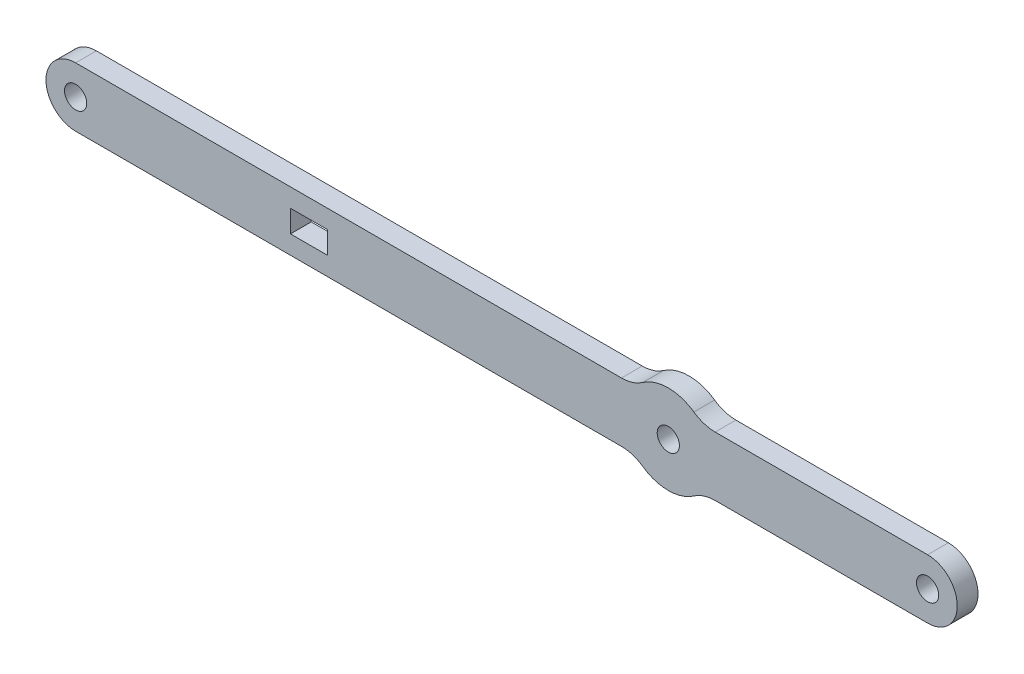
from build123d import *

# Parameters (mm, degrees)
SKETCH1_R           = 1.5
SKETCH1_W           = 5
SKETCH1_H           = 3
BOSS_EXTRUDE1_DEPTH = 2.8
FILLET1_R           = 5


with BuildPart() as part:
    # Sketch1 → Boss-Extrude1 (new body)
    with BuildSketch(Plane.XY):
        with BuildLine():
            Line((0.006174378, 4.000000753), (75.527864276, 4.000000258))
            ThreePointArc((75.527864276, 4.000000258), (80.000000039, 6), (84.472135776, 4.0000002))
            Line((84.472135776, 4.0000002), (115.000000079, 4))
            ThreePointArc((115.000000079, 4), (119, -5.2e-08), (114.999999974, -4))
            Line((114.999999974, -4), (84.472136134, -3.9999998))
            ThreePointArc((84.472136134, -3.9999998), (79.999999961, -6), (75.527863814, -3.999999742))
            Line((75.527863814, -3.999999742), (-0.007082675, -3.999999247))
            ThreePointArc((-0.007082675, -3.999999247), (-4.000000026, 0.006628527), (0.006174378, 4.000000753))
        make_face()
        with Locations((80, 0)):
            Circle(SKETCH1_R, mode=Mode.SUBTRACT)
        with Locations((115, 0)):
            Circle(SKETCH1_R, mode=Mode.SUBTRACT)
        Circle(SKETCH1_R, mode=Mode.SUBTRACT)
        with Locations((31.499999974, 0)):
            Rectangle(SKETCH1_W, SKETCH1_H, mode=Mode.SUBTRACT)
    extrude(amount=BOSS_EXTRUDE1_DEPTH)

    # Fillet1
    fillet1_edges = [part.edges().sort_by_distance(p)[0] for p in [
        (75.527864276, 4.000000258, 1.4),
        (84.472135776, 4.0000002, 1.4),
        (84.472136134, -3.9999998, 1.4),
        (75.527863814, -3.999999742, 1.4),
    ]]
    fillet(fillet1_edges, radius=FILLET1_R)


solid = part.part
